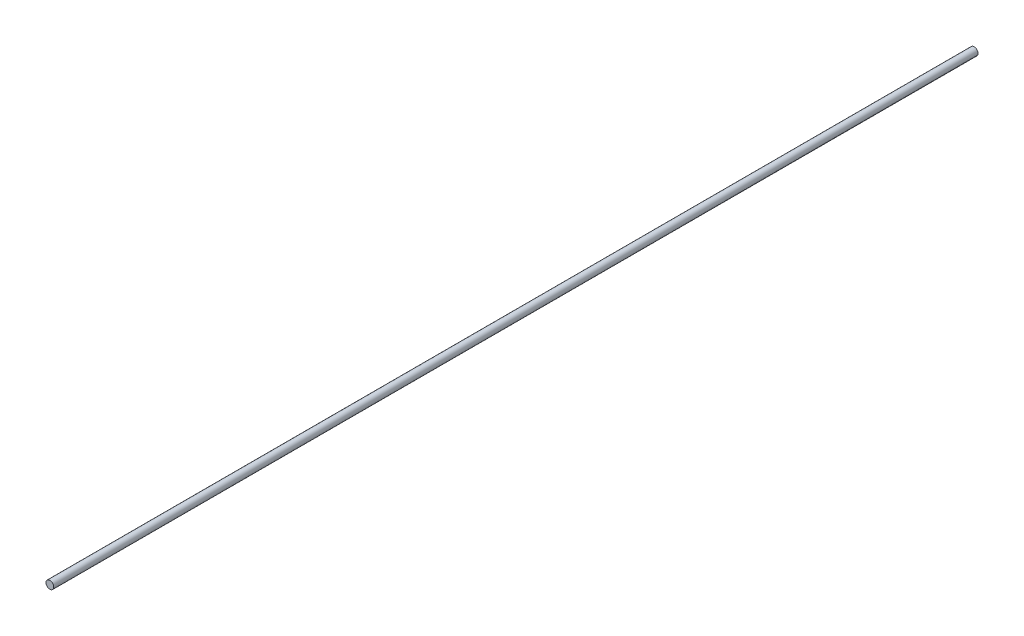
from build123d import *

# Parameters (mm, degrees)
ESQUISSE1_R        = 3
BOSS_EXTRU_1_DEPTH = 715


with BuildPart() as part:
    # Esquisse1 → Boss.-Extru.1 (new body)
    with BuildSketch(Plane.XY):
        Circle(ESQUISSE1_R)
    extrude(amount=BOSS_EXTRU_1_DEPTH)


solid = part.part
